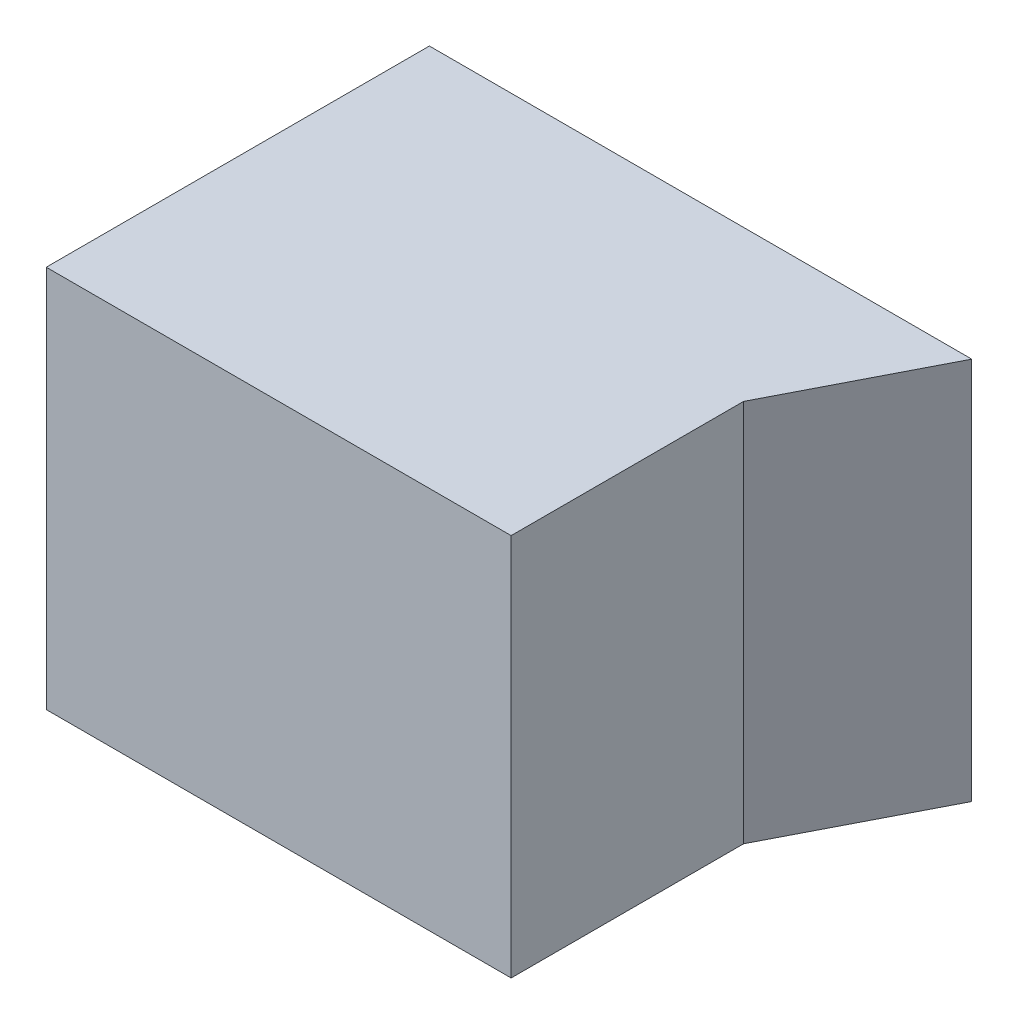
from build123d import *

# Parameters (mm, degrees)
SKETCH10_W          = 2.54
SKETCH10_H          = 5.08
SKETCH10_W_2        = 5.08
SKETCH10_H_2        = 2.54
BOSS_EXTRUDE3_DEPTH = 25.4
SKETCH11_W          = 31.4
SKETCH11_H          = 31.4
SKETCH11_W_2        = 25.4
SKETCH11_H_2        = 25.4
BOSS_EXTRUDE5_DEPTH = 25.4
BOSS_EXTRUDE6_DEPTH = 31.4


with BuildPart() as part:
    # Sketch10 → Boss-Extrude3 (new body)
    with BuildSketch(Plane(origin=(0, 0, 0), x_dir=(0, 0, -1), z_dir=(1, 0, 0))):
        with Locations((-11.43, 0)):
            Rectangle(SKETCH10_W, SKETCH10_H)
        with BuildLine():
            Line((-5.08, 2.54), (-9.740509205, 6.542688341))
            ThreePointArc((-9.740509205, 6.542688341), (-10.012022021, 6.580814495), (-10.16, 6.35))
            Line((-10.16, 6.35), (-10.16, -6.35))
            ThreePointArc((-10.16, -6.35), (-10.012022021, -6.580814495), (-9.740509205, -6.542688341))
            Line((-9.740509205, -6.542688341), (-5.08, -2.54))
            Line((-5.08, -2.54), (-5.08, 2.54))
        make_face()
        with BuildLine():
            Line((6.35, 10.16), (-6.35, 10.16))
            ThreePointArc((-6.35, 10.16), (-6.580814495, 10.012022021), (-6.542688341, 9.740509205))
            Line((-6.542688341, 9.740509205), (-2.54, 5.08))
            Line((-2.54, 5.08), (2.54, 5.08))
            Line((2.54, 5.08), (6.542688341, 9.740509205))
            ThreePointArc((6.542688341, 9.740509205), (6.580814495, 10.012022021), (6.35, 10.16))
        make_face()
        with Locations((0, 11.43)):
            Rectangle(SKETCH10_W_2, SKETCH10_H_2)
        with BuildLine():
            ThreePointArc((6.542688341, -9.740509205), (6.580814495, -10.012022021), (6.35, -10.16))
            Line((6.35, -10.16), (-6.35, -10.16))
            ThreePointArc((-6.35, -10.16), (-6.580814495, -10.012022021), (-6.542688341, -9.740509205))
            Line((-6.542688341, -9.740509205), (-2.54, -5.08))
            Line((-2.54, -5.08), (2.54, -5.08))
            Line((2.54, -5.08), (6.542688341, -9.740509205))
        make_face()
        with Locations((0, -11.43)):
            Rectangle(SKETCH10_W_2, SKETCH10_H_2)
        with BuildLine():
            Line((5.08, 2.54), (5.08, -2.54))
            Line((5.08, -2.54), (9.740509205, -6.542688341))
            ThreePointArc((9.740509205, -6.542688341), (10.012022021, -6.580814495), (10.16, -6.35))
            Line((10.16, -6.35), (10.16, -2.54))
            Line((10.16, -2.54), (10.16, 2.54))
            Line((10.16, 2.54), (10.16, 6.35))
            ThreePointArc((10.16, 6.35), (10.012022021, 6.580814495), (9.740509205, 6.542688341))
            Line((9.740509205, 6.542688341), (5.08, 2.54))
        make_face()
        with Locations((11.43, 0)):
            Rectangle(SKETCH10_W, SKETCH10_H)
    extrude(amount=-BOSS_EXTRUDE3_DEPTH)

    # Sketch11 → Boss-Extrude5 (add, through all)
    with BuildSketch(Plane(origin=(0, 0, 0), x_dir=(0, 0, -1), z_dir=(1, 0, 0))):
        Rectangle(SKETCH11_W, SKETCH11_H)
        Rectangle(SKETCH11_W_2, SKETCH11_H_2, mode=Mode.SUBTRACT)
    extrude(amount=-BOSS_EXTRUDE5_DEPTH)

    # Sketch13 → Boss-Extrude6 (add, through all)
    with BuildSketch(Plane.XZ.offset(15.7)):
        Polygon((0, 15.7), (12.7, 15.7), (12.7, -3.35), (19.05, -15.7), (0, -15.7), align=None)
    extrude(amount=-BOSS_EXTRUDE6_DEPTH)


solid = part.part
